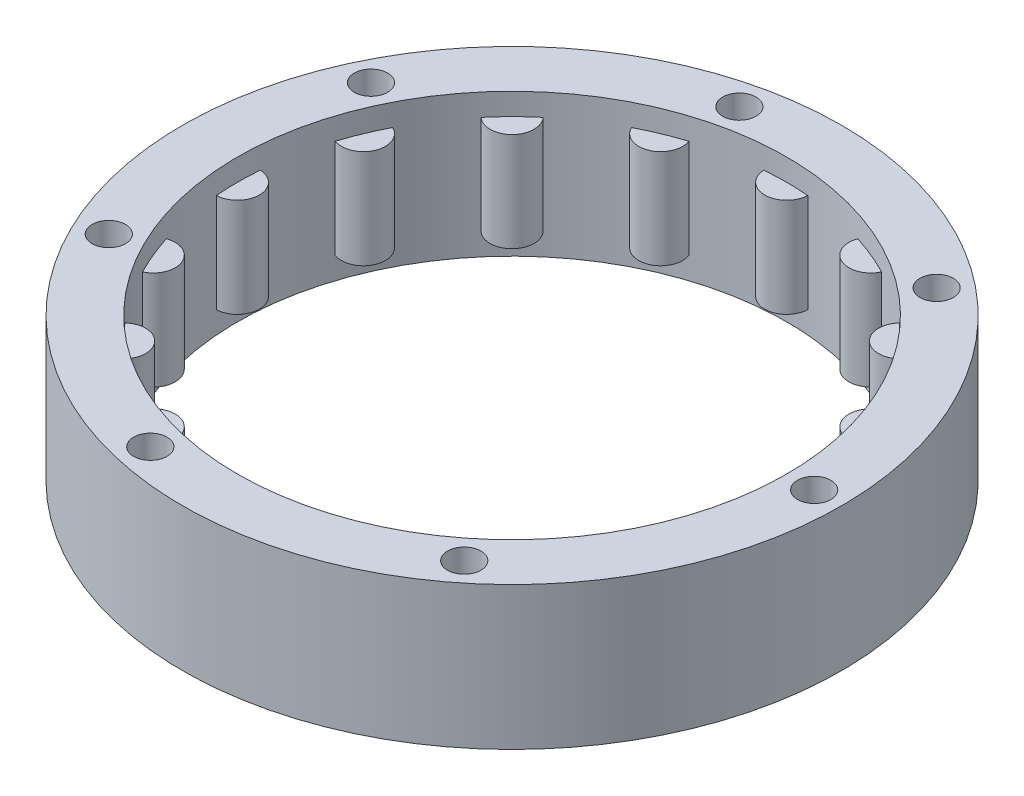
from build123d import *

# Parameters (mm, degrees)
CROQUIS1_R                 = 2
SALIENTE_EXTRUIR1_DEPTH    = 4.5
SALIENTE_EXTRUIR1_2_DEPTH  = 4.5
SALIENTE_EXTRUIR1_3_DEPTH  = 4.5
SALIENTE_EXTRUIR1_4_DEPTH  = 4.5
SALIENTE_EXTRUIR1_5_DEPTH  = 4.5
SALIENTE_EXTRUIR1_6_DEPTH  = 4.5
SALIENTE_EXTRUIR1_7_DEPTH  = 4.5
SALIENTE_EXTRUIR1_8_DEPTH  = 4.5
SALIENTE_EXTRUIR1_9_DEPTH  = 4.5
SALIENTE_EXTRUIR1_10_DEPTH = 4.5
SALIENTE_EXTRUIR1_11_DEPTH = 4.5
SALIENTE_EXTRUIR1_12_DEPTH = 4.5
SALIENTE_EXTRUIR1_13_DEPTH = 4.5
SALIENTE_EXTRUIR1_14_DEPTH = 4.5
SALIENTE_EXTRUIR1_15_DEPTH = 4.5
SALIENTE_EXTRUIR1_16_DEPTH = 4.5
CROQUIS3_R                 = 30
CROQUIS3_R_2               = 25
SALIENTE_EXTRUIR2_DEPTH    = 6.5
CROQUIS4_R                 = 1.52
CORTAR_EXTRUIR1_DEPTH      = 45.373415465


with BuildPart() as part:
    # Croquis1 → Saliente-Extruir1 (new, symmetric)
    with BuildSketch(Plane(origin=(0, 0, 0), x_dir=(1, 0, 0), z_dir=(0, 1, 0))):
        with Locations(Location((25, 0, 0), (0, 0, 270))):
            Circle(CROQUIS1_R)
    extrude(amount=SALIENTE_EXTRUIR1_DEPTH, both=True)



with BuildPart() as body_2:
    # Croquis1 → Saliente-Extruir1 2 (new, symmetric)
    with BuildSketch(Plane(origin=(0, 0, 0), x_dir=(1, 0, 0), z_dir=(0, 1, 0))):
        with Locations(Location((23.096988313, -9.567085809, 0), (0, 0, 270))):
            Circle(CROQUIS1_R)
    extrude(amount=SALIENTE_EXTRUIR1_2_DEPTH, both=True)


with BuildPart() as body_3:
    # Croquis1 → Saliente-Extruir1 3 (new, symmetric)
    with BuildSketch(Plane(origin=(0, 0, 0), x_dir=(1, 0, 0), z_dir=(0, 1, 0))):
        with Locations(Location((17.67766953, -17.67766953, 0), (0, 0, 270))):
            Circle(CROQUIS1_R)
    extrude(amount=SALIENTE_EXTRUIR1_3_DEPTH, both=True)


with BuildPart() as body_4:
    # Croquis1 → Saliente-Extruir1 4 (new, symmetric)
    with BuildSketch(Plane(origin=(0, 0, 0), x_dir=(1, 0, 0), z_dir=(0, 1, 0))):
        with Locations(Location((9.567085809, -23.096988313, 0), (0, 0, 270))):
            Circle(CROQUIS1_R)
    extrude(amount=SALIENTE_EXTRUIR1_4_DEPTH, both=True)


with BuildPart() as body_5:
    # Croquis1 → Saliente-Extruir1 5 (new, symmetric)
    with BuildSketch(Plane(origin=(0, 0, 0), x_dir=(1, 0, 0), z_dir=(0, 1, 0))):
        with Locations(Location((0, -25, 0), (0, 0, 270))):
            Circle(CROQUIS1_R)
    extrude(amount=SALIENTE_EXTRUIR1_5_DEPTH, both=True)


with BuildPart() as body_6:
    # Croquis1 → Saliente-Extruir1 6 (new, symmetric)
    with BuildSketch(Plane(origin=(0, 0, 0), x_dir=(1, 0, 0), z_dir=(0, 1, 0))):
        with Locations(Location((-9.567085809, -23.096988313, 0), (0, 0, 270))):
            Circle(CROQUIS1_R)
    extrude(amount=SALIENTE_EXTRUIR1_6_DEPTH, both=True)


with BuildPart() as body_7:
    # Croquis1 → Saliente-Extruir1 7 (new, symmetric)
    with BuildSketch(Plane(origin=(0, 0, 0), x_dir=(1, 0, 0), z_dir=(0, 1, 0))):
        with Locations(Location((-17.67766953, -17.67766953, 0), (0, 0, 270))):
            Circle(CROQUIS1_R)
    extrude(amount=SALIENTE_EXTRUIR1_7_DEPTH, both=True)


with BuildPart() as body_8:
    # Croquis1 → Saliente-Extruir1 8 (new, symmetric)
    with BuildSketch(Plane(origin=(0, 0, 0), x_dir=(1, 0, 0), z_dir=(0, 1, 0))):
        with Locations(Location((-23.096988313, -9.567085809, 0), (0, 0, 270))):
            Circle(CROQUIS1_R)
    extrude(amount=SALIENTE_EXTRUIR1_8_DEPTH, both=True)


with BuildPart() as body_9:
    # Croquis1 → Saliente-Extruir1 9 (new, symmetric)
    with BuildSketch(Plane(origin=(0, 0, 0), x_dir=(1, 0, 0), z_dir=(0, 1, 0))):
        with Locations(Location((-25, 0, 0), (0, 0, 270))):
            Circle(CROQUIS1_R)
    extrude(amount=SALIENTE_EXTRUIR1_9_DEPTH, both=True)


with BuildPart() as body_10:
    # Croquis1 → Saliente-Extruir1 10 (new, symmetric)
    with BuildSketch(Plane(origin=(0, 0, 0), x_dir=(1, 0, 0), z_dir=(0, 1, 0))):
        with Locations(Location((-23.096988313, 9.567085809, 0), (0, 0, 270))):
            Circle(CROQUIS1_R)
    extrude(amount=SALIENTE_EXTRUIR1_10_DEPTH, both=True)


with BuildPart() as body_11:
    # Croquis1 → Saliente-Extruir1 11 (new, symmetric)
    with BuildSketch(Plane(origin=(0, 0, 0), x_dir=(1, 0, 0), z_dir=(0, 1, 0))):
        with Locations(Location((-17.67766953, 17.67766953, 0), (0, 0, 270))):
            Circle(CROQUIS1_R)
    extrude(amount=SALIENTE_EXTRUIR1_11_DEPTH, both=True)


with BuildPart() as body_12:
    # Croquis1 → Saliente-Extruir1 12 (new, symmetric)
    with BuildSketch(Plane(origin=(0, 0, 0), x_dir=(1, 0, 0), z_dir=(0, 1, 0))):
        with Locations(Location((-9.567085809, 23.096988313, 0), (0, 0, 270))):
            Circle(CROQUIS1_R)
    extrude(amount=SALIENTE_EXTRUIR1_12_DEPTH, both=True)


with BuildPart() as body_13:
    # Croquis1 → Saliente-Extruir1 13 (new, symmetric)
    with BuildSketch(Plane(origin=(0, 0, 0), x_dir=(1, 0, 0), z_dir=(0, 1, 0))):
        with Locations(Location((0, 25, 0), (0, 0, 270))):
            Circle(CROQUIS1_R)
    extrude(amount=SALIENTE_EXTRUIR1_13_DEPTH, both=True)


with BuildPart() as body_14:
    # Croquis1 → Saliente-Extruir1 14 (new, symmetric)
    with BuildSketch(Plane(origin=(0, 0, 0), x_dir=(1, 0, 0), z_dir=(0, 1, 0))):
        with Locations(Location((9.567085809, 23.096988313, 0), (0, 0, 270))):
            Circle(CROQUIS1_R)
    extrude(amount=SALIENTE_EXTRUIR1_14_DEPTH, both=True)


with BuildPart() as body_15:
    # Croquis1 → Saliente-Extruir1 15 (new, symmetric)
    with BuildSketch(Plane(origin=(0, 0, 0), x_dir=(1, 0, 0), z_dir=(0, 1, 0))):
        with Locations(Location((17.67766953, 17.67766953, 0), (0, 0, 270))):
            Circle(CROQUIS1_R)
    extrude(amount=SALIENTE_EXTRUIR1_15_DEPTH, both=True)


with BuildPart() as body_16:
    # Croquis1 → Saliente-Extruir1 16 (new, symmetric)
    with BuildSketch(Plane(origin=(0, 0, 0), x_dir=(1, 0, 0), z_dir=(0, 1, 0))):
        with Locations(Location((23.096988313, 9.567085809, 0), (0, 0, 270))):
            Circle(CROQUIS1_R)
    extrude(amount=SALIENTE_EXTRUIR1_16_DEPTH, both=True)


with BuildPart() as part_1:
    add(part.part)

    add(body_2.part)  # Saliente-Extruir2 merges body 2

    add(body_3.part)  # Saliente-Extruir2 merges body 3

    add(body_4.part)  # Saliente-Extruir2 merges body 4

    add(body_5.part)  # Saliente-Extruir2 merges body 5

    add(body_6.part)  # Saliente-Extruir2 merges body 6

    add(body_7.part)  # Saliente-Extruir2 merges body 7

    add(body_8.part)  # Saliente-Extruir2 merges body 8

    add(body_9.part)  # Saliente-Extruir2 merges body 9

    add(body_10.part)  # Saliente-Extruir2 merges body 10

    add(body_11.part)  # Saliente-Extruir2 merges body 11

    add(body_12.part)  # Saliente-Extruir2 merges body 12

    add(body_13.part)  # Saliente-Extruir2 merges body 13

    add(body_14.part)  # Saliente-Extruir2 merges body 14

    add(body_15.part)  # Saliente-Extruir2 merges body 15

    add(body_16.part)  # Saliente-Extruir2 merges body 16
    # Croquis3 → Saliente-Extruir2 (add, symmetric)
    with BuildSketch(Plane(origin=(0, 0, 0), x_dir=(1, 0, 0), z_dir=(0, 1, 0))):
        with Locations(Location((0, 0, 0), (0, 0, 90))):
            Circle(CROQUIS3_R)
        with Locations(Location((0, 0, 0), (0, 0, 270))):
            Circle(CROQUIS3_R_2, mode=Mode.SUBTRACT)
    extrude(amount=SALIENTE_EXTRUIR2_DEPTH, both=True)

    # Croquis4 → Cortar-Extruir1 (cut, through all)
    with BuildSketch(Plane(origin=(0, 6.5, 0), x_dir=(1, 0, 0), z_dir=(0, 1, 0))):
        with Locations(Location((27.5, 0, 0), (0, 0, 270))):
            Circle(CROQUIS4_R)
        with Locations(Location((17.145969551, -21.500365768, 0), (0, 0, 270))):
            Circle(CROQUIS4_R)
        with Locations(Location((-6.119325684, -26.810517585, 0), (0, 0, 270))):
            Circle(CROQUIS4_R)
        with Locations(Location((-24.776643867, -11.931802826, 0), (0, 0, 270))):
            Circle(CROQUIS4_R)
        with Locations(Location((-24.776643867, 11.931802826, 0), (0, 0, 270))):
            Circle(CROQUIS4_R)
        with Locations(Location((-6.119325684, 26.810517585, 0), (0, 0, 270))):
            Circle(CROQUIS4_R)
        with Locations(Location((17.145969551, 21.500365768, 0), (0, 0, 270))):
            Circle(CROQUIS4_R)
    extrude(amount=-CORTAR_EXTRUIR1_DEPTH, mode=Mode.SUBTRACT)


solid = part_1.part
